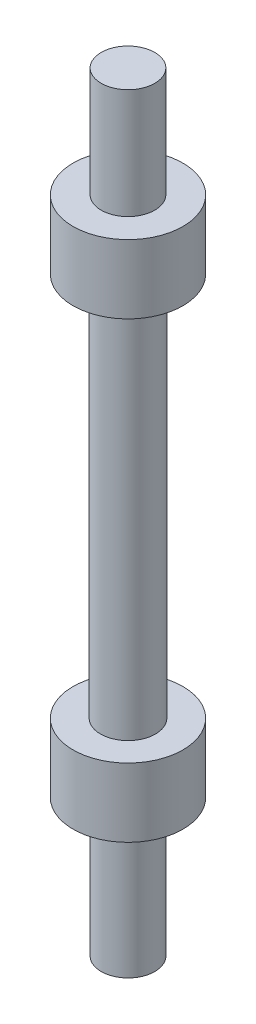
from build123d import *

# Parameters (mm, degrees)
SKETCH1_R           = 2
BOSS_EXTRUDE1_DEPTH = 28
SKETCH2_R           = 4
BOSS_EXTRUDE2_DEPTH = 5
SKETCH3_R           = 1.95
BOSS_EXTRUDE3_DEPTH = 10
BOSS_EXTRUDE5_START = 5
SKETCH7_R           = 4
BOSS_EXTRUDE5_DEPTH = 5
BOSS_EXTRUDE6_START = 8
SKETCH8_R           = 1.95
BOSS_EXTRUDE6_DEPTH = 8


with BuildPart() as part:
    # Sketch1 → Boss-Extrude1 (new body)
    with BuildSketch(Plane(origin=(0, 0, 0), x_dir=(1, 0, 0), z_dir=(0, 1, 0))):
        with Locations(Location((0, 0, 0), (0, 0, 270))):
            Circle(SKETCH1_R)
    extrude(amount=BOSS_EXTRUDE1_DEPTH)

    # Sketch2 → Boss-Extrude2 (add)
    with BuildSketch(Plane.XZ):
        with Locations(Location((0, 0, 0), (0, 0, 270))):
            Circle(SKETCH2_R)
    extrude(amount=BOSS_EXTRUDE2_DEPTH)

    # Sketch3 → Boss-Extrude3 (add)
    with BuildSketch(Plane.XZ.offset(5)):
        with Locations(Location((0, 0, 0), (0, 0, 270))):
            Circle(SKETCH3_R)
    extrude(amount=BOSS_EXTRUDE3_DEPTH)

    # Sketch7 → Boss-Extrude5 (add)
    with BuildSketch(Plane(origin=(0, 28, 0), x_dir=(1, 0, 0), z_dir=(0, 1, 0)).offset(BOSS_EXTRUDE5_START)):
        with Locations(Location((0, 0, 0), (0, 0, 90))):
            Circle(SKETCH7_R)
    extrude(amount=-BOSS_EXTRUDE5_DEPTH)

    # Sketch8 → Boss-Extrude6 (add)
    with BuildSketch(Plane(origin=(0, 33, 0), x_dir=(1, 0, 0), z_dir=(0, 1, 0)).offset(BOSS_EXTRUDE6_START)):
        with Locations(Location((0, 0, 0), (0, 0, 90))):
            Circle(SKETCH8_R)
    extrude(amount=-BOSS_EXTRUDE6_DEPTH)


solid = part.part
